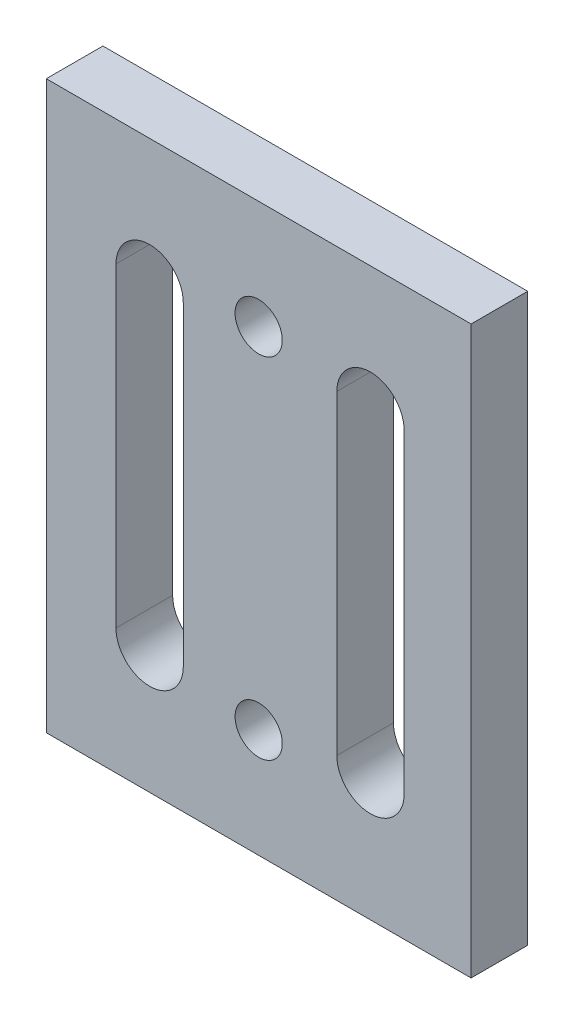
from build123d import *

# Parameters (mm, degrees)
SKETCH1_W           = 45
SKETCH1_H           = 60
SKETCH1_R           = 2.5
BOSS_EXTRUDE1_DEPTH = 6


with BuildPart() as part:
    # Sketch1 → Boss-Extrude1 (new body)
    with BuildSketch(Plane(origin=(0, 0, 0), x_dir=(-1, 0, 0), z_dir=(0, 0, -1))):
        Rectangle(SKETCH1_W, SKETCH1_H)
        with Locations((0, 18.5)):
            Circle(SKETCH1_R, mode=Mode.SUBTRACT)
        with Locations((0, -18.5)):
            Circle(SKETCH1_R, mode=Mode.SUBTRACT)
        with BuildLine():
            Line((-8.277280201, 16.7), (-8.277280201, -16.7))
            ThreePointArc((-8.277280201, -16.7), (-11.841231537, -20.263951335), (-15.405182872, -16.7))
            Line((-15.405182872, -16.7), (-15.405182872, 16.7))
            ThreePointArc((-15.405182872, 16.7), (-11.841231537, 20.263951335), (-8.277280201, 16.7))
        make_face(mode=Mode.SUBTRACT)
        with BuildLine():
            Line((7.987422003, 16.7), (7.987422003, -16.7))
            ThreePointArc((7.987422003, -16.7), (11.551373339, -20.263951335), (15.115324674, -16.7))
            Line((15.115324674, -16.7), (15.115324674, 16.7))
            ThreePointArc((15.115324674, 16.7), (11.551373339, 20.263951335), (7.987422003, 16.7))
        make_face(mode=Mode.SUBTRACT)
    extrude(amount=-BOSS_EXTRUDE1_DEPTH)


solid = part.part
